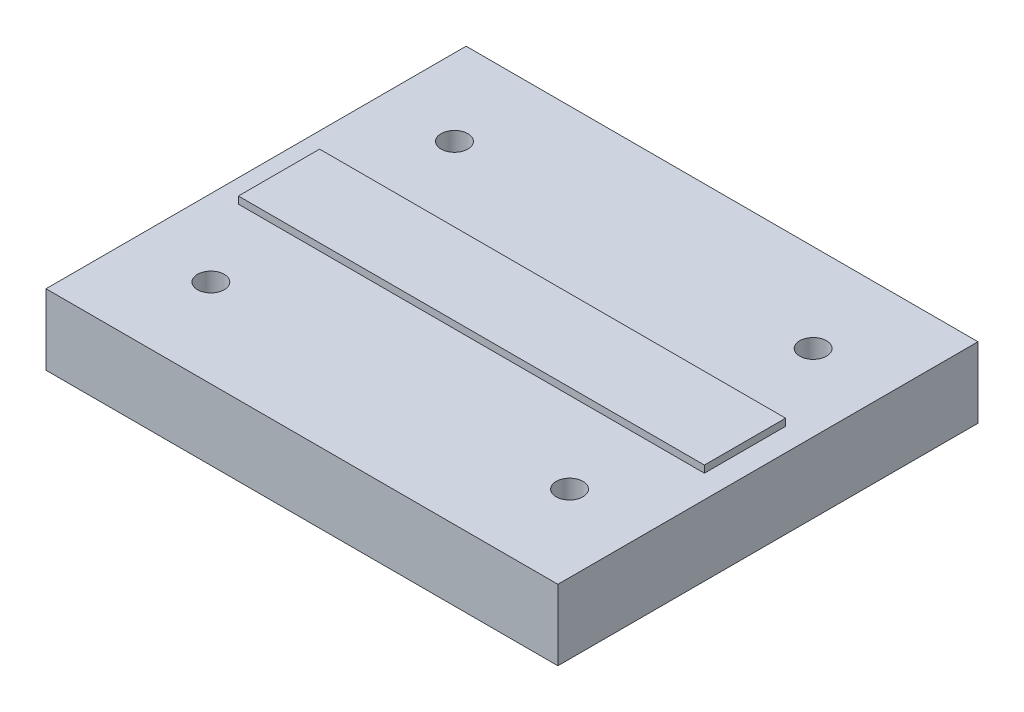
from build123d import *

# Parameters (mm, degrees)
SKETCH1_W                  = 72.5
SKETCH1_H                  = 59.5
BOSS_EXTRUDE1_DEPTH        = 10
SKETCH4_W                  = 66
SKETCH4_H                  = 11.5
BOSS_EXTRUDE3_DEPTH        = 1
TAP_DRILL_FOR_10_24_TAP1_D = 3.7973


with BuildPart() as part:
    # Sketch1 → Boss-Extrude1 (new body)
    with BuildSketch(Plane(origin=(0, 0, 0), x_dir=(1, 0, 0), z_dir=(0, 1, 0))):
        with Locations((36.25, 29.75)):
            Rectangle(SKETCH1_W, SKETCH1_H)
    extrude(amount=BOSS_EXTRUDE1_DEPTH)

    # Sketch4 → Boss-Extrude3 (add)
    with BuildSketch(Plane(origin=(0, 10, 0), x_dir=(1, 0, 0), z_dir=(0, 1, 0))):
        with Locations((36.25, 29.75)):
            Rectangle(SKETCH4_W, SKETCH4_H)
    extrude(amount=BOSS_EXTRUDE3_DEPTH)

    # Tap Drill for #10-24 Tap1 (through all)
    with Locations(Plane(origin=(0, 10, 0), x_dir=(1, 0, 0), z_dir=(0, 1, 0))):
        with Locations((10.85, 47), (61.65, 47), (10.85, 12.5), (61.65, 12.5)):
            Hole(TAP_DRILL_FOR_10_24_TAP1_D / 2)


solid = part.part
